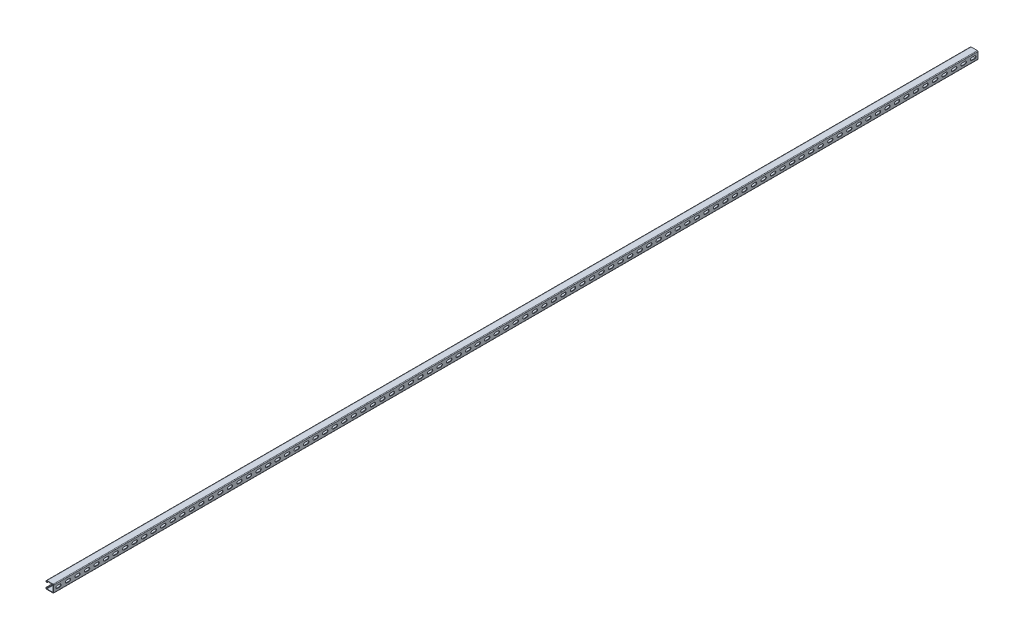
from build123d import *

# Parameters (mm, degrees)
BOSS_EXTRUDE1_DEPTH = 4927.6
CUT_EXTRUDE1_DEPTH  = 2.794
LPATTERN1_COUNT     = 97
LPATTERN1_PITCH     = 50.8


with BuildPart() as part:
    # Sketch1 → Boss-Extrude1 (new body)
    with BuildSketch(Plane.XY):
        with BuildLine():
            Line((-36.22675, 20.6375), (-3.46075, 20.6375))
            ThreePointArc((-3.46075, 20.6375), (-1.013630207, 19.623869793), (0, 17.17675))
            Line((0, 17.17675), (0, -17.17675))
            ThreePointArc((0, -17.17675), (-1.013630207, -19.623869793), (-3.46075, -20.6375))
            Line((-3.46075, -20.6375), (-36.22675, -20.6375))
            ThreePointArc((-36.22675, -20.6375), (-39.796401808, -19.158901808), (-41.275, -15.58925))
            Line((-41.275, -15.58925), (-41.275, -14.57325))
            ThreePointArc((-41.275, -14.57325), (-40.261369793, -12.126130207), (-37.81425, -11.1125))
            Line((-37.81425, -11.1125), (-35.5346, -11.1125))
            ThreePointArc((-35.5346, -11.1125), (-34.1376, -12.5095), (-35.5346, -13.9065))
            Line((-35.5346, -13.9065), (-37.81425, -13.9065))
            ThreePointArc((-37.81425, -13.9065), (-38.285713446, -14.101786554), (-38.481, -14.57325))
            Line((-38.481, -14.57325), (-38.481, -15.58925))
            ThreePointArc((-38.481, -15.58925), (-37.820745461, -17.183245461), (-36.22675, -17.8435))
            Line((-36.22675, -17.8435), (-3.46075, -17.8435))
            ThreePointArc((-3.46075, -17.8435), (-2.989286554, -17.648213446), (-2.794, -17.17675))
            Line((-2.794, -17.17675), (-2.794, 17.17675))
            ThreePointArc((-2.794, 17.17675), (-2.989286554, 17.648213446), (-3.46075, 17.8435))
            Line((-3.46075, 17.8435), (-36.22675, 17.8435))
            ThreePointArc((-36.22675, 17.8435), (-37.820745461, 17.183245461), (-38.481, 15.58925))
            Line((-38.481, 15.58925), (-38.481, 14.57325))
            ThreePointArc((-38.481, 14.57325), (-38.285713446, 14.101786554), (-37.81425, 13.9065))
            Line((-37.81425, 13.9065), (-35.5346, 13.9065))
            ThreePointArc((-35.5346, 13.9065), (-34.1376, 12.5095), (-35.5346, 11.1125))
            Line((-35.5346, 11.1125), (-37.81425, 11.1125))
            ThreePointArc((-37.81425, 11.1125), (-40.261369793, 12.126130207), (-41.275, 14.57325))
            Line((-41.275, 14.57325), (-41.275, 15.58925))
            ThreePointArc((-41.275, 15.58925), (-39.796401808, 19.158901808), (-36.22675, 20.6375))
        make_face()
    extrude(amount=-BOSS_EXTRUDE1_DEPTH)

    # Sketch2 → Cut-Extrude1 (cut)
    with BuildSketch(Plane(origin=(0, 0, 0), x_dir=(0, 0, -1), z_dir=(1, 0, 0))):
        with BuildLine():
            Line((18.25625, 7.14375), (32.54375, 7.14375))
            ThreePointArc((32.54375, 7.14375), (39.6875, 0), (32.54375, -7.14375))
            Line((32.54375, -7.14375), (18.25625, -7.14375))
            ThreePointArc((18.25625, -7.14375), (11.1125, 0), (18.25625, 7.14375))
        make_face()
    cut_extrude1 = extrude(amount=-CUT_EXTRUDE1_DEPTH, mode=Mode.SUBTRACT)

    # LPattern1: Cut-Extrude1 ×97
    with Locations(*[(0, 0, -i * LPATTERN1_PITCH) for i in range(1, LPATTERN1_COUNT)]):
        add(cut_extrude1, mode=Mode.SUBTRACT)


solid = part.part
